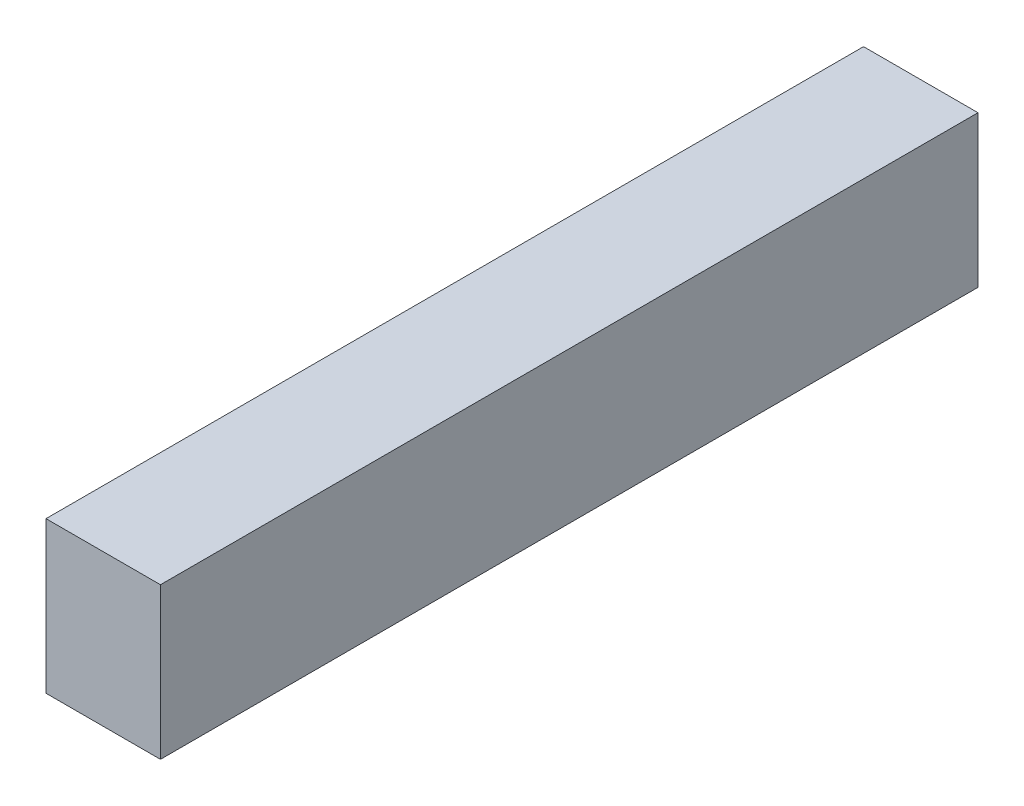
from build123d import *

# Parameters (mm, degrees)
SKETCH1_W      = 3.556
SKETCH1_H      = 4.699
EXTRUDE1_DEPTH = 25.4


with BuildPart() as part:
    # Sketch1 → Extrude1 (new body)
    with BuildSketch(Plane.XY):
        Rectangle(SKETCH1_W, SKETCH1_H)
    extrude(amount=-EXTRUDE1_DEPTH)


solid = part.part
